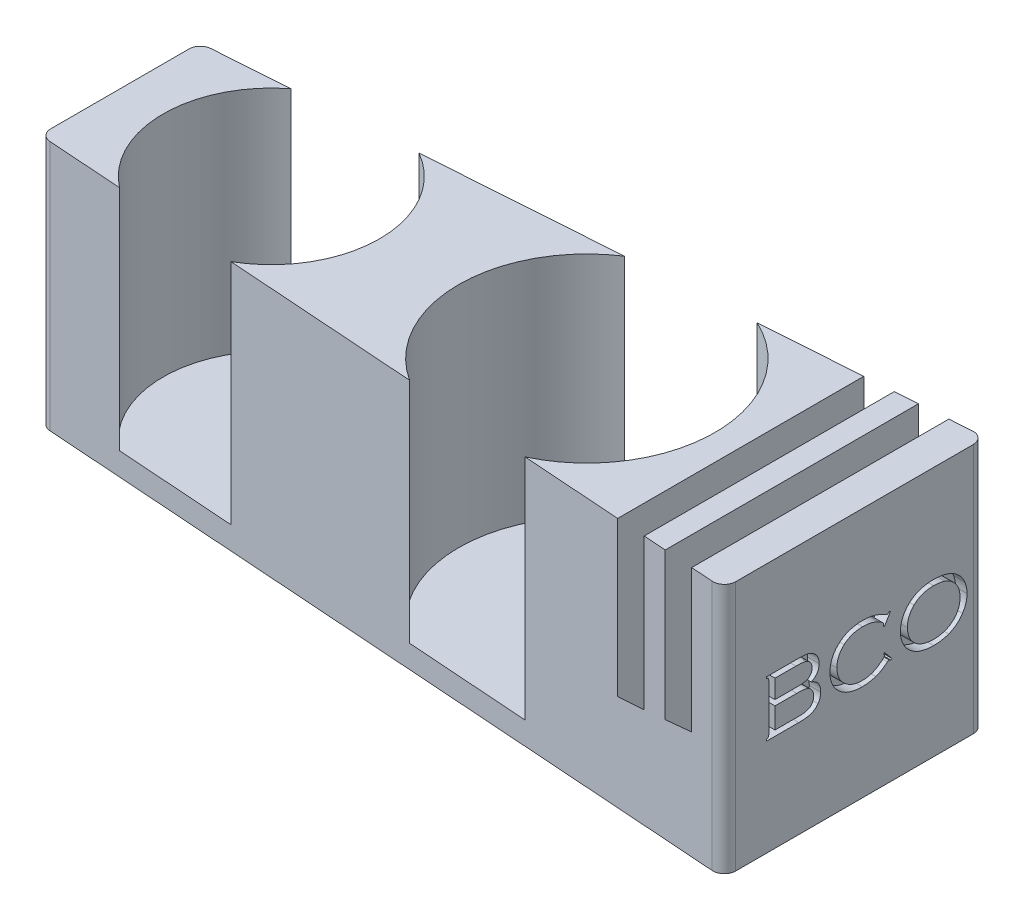
from build123d import *

# Parameters (mm, degrees)
BOSS_EXTRUDE1_DEPTH = 2
BOSS_EXTRUDE2_DEPTH = 20
BOSS_EXTRUDE3_DEPTH = 20
SKETCH5_R           = 12.25
CUT_EXTRUDE1_DEPTH  = 2.5
SKETCH6_W           = 22.580720552
SKETCH6_H           = 12.500036581
CUT_EXTRUDE3_DEPTH  = 2.5
BOSS_EXTRUDE4_DEPTH = 20
BOSS_EXTRUDE5_DEPTH = 20
SKETCH10_R          = 12.25
CUT_EXTRUDE4_DEPTH  = 2.5
CUT_EXTRUDE5_DEPTH  = 2.5
BOSS_EXTRUDE6_DEPTH = 20
SKETCH13_R          = 9.5
CUT_EXTRUDE6_DEPTH  = 20
SKETCH14_R          = 11.25
CUT_EXTRUDE7_DEPTH  = 20
CUT_EXTRUDE8_DEPTH  = 1
FILLET2_R           = 1


with BuildPart() as part:
    # Sketch1 → Boss-Extrude1 (new body)
    with BuildSketch(Plane(origin=(0, 0, 0), x_dir=(1, 0, 0), z_dir=(0, 1, 0))):
        Polygon((0, 7), (64.5, 11.5), (64.5, -11.5), (0, -7), align=None)
    extrude(amount=BOSS_EXTRUDE1_DEPTH)

    # Sketch2 → Boss-Extrude2 (add)
    with BuildSketch(Plane(origin=(0, 2, 0), x_dir=(1, 0, 0), z_dir=(0, 1, 0))):
        Polygon((61.502303199, 11.290858363), (61.497417875, -11.290517526), (64.5, -11.5), (64.5, 11.5), align=None)
    extrude(amount=BOSS_EXTRUDE2_DEPTH)

    # Sketch4 → Boss-Extrude3 (add)
    with BuildSketch(Plane(origin=(0, 2, 0), x_dir=(1, 0, 0), z_dir=(0, 1, 0))):
        Polygon((61.497417875, -11.290517526), (61.502303199, 11.290858363), (58.995164106, 11.115941682), (58.995163799, -11.11594166), align=None)
    extrude(amount=BOSS_EXTRUDE3_DEPTH)

    # Sketch5 → Cut-Extrude1 (cut)
    with BuildSketch(Plane(origin=(58.995163952, 0, 8.13e-07), x_dir=(-1.3778228676003005e-08, 0, 1.0), z_dir=(-1.0, 0, -1.3778228676003005e-08))):
        with Locations((0, 14.252883097)):
            Circle(SKETCH5_R)
    extrude(amount=-CUT_EXTRUDE1_DEPTH, mode=Mode.SUBTRACT)

    # Sketch6 → Cut-Extrude3 (cut)
    with BuildSketch(Plane(origin=(61.495163952, 0, 8.47e-07), x_dir=(-1.3778228676003005e-08, 0, 1.0), z_dir=(-1.0, 0, -1.3778228676003005e-08))):
        with Locations((-8.58e-07, 15.74998171)):
            Rectangle(SKETCH6_W, SKETCH6_H)
    extrude(amount=CUT_EXTRUDE3_DEPTH, mode=Mode.SUBTRACT)

    # Sketch8 → Boss-Extrude4 (add)
    with BuildSketch(Plane(origin=(0, 2, 0), x_dir=(1, 0, 0), z_dir=(0, 1, 0))):
        Polygon((58.995164106, 11.115941682), (57.006604835, 10.977204988), (57.006604835, -10.977204988), (58.995163799, -11.11594166), align=None)
    extrude(amount=BOSS_EXTRUDE4_DEPTH)

    # Sketch9 → Boss-Extrude5 (add)
    with BuildSketch(Plane(origin=(0, 2, 0), x_dir=(1, 0, 0), z_dir=(0, 1, 0))):
        Polygon((57.006604835, 10.977204988), (54.508882385, 10.802945283), (54.508862519, -10.802943897), (57.006604835, -10.977204988), align=None)
    extrude(amount=BOSS_EXTRUDE5_DEPTH)

    # Sketch10 → Cut-Extrude4 (cut)
    with BuildSketch(Plane(origin=(54.508872452, 0, 5.0119e-05), x_dir=(-9.194676961695594e-07, 0, 0.9999999999995773), z_dir=(-0.9999999999995773, 0, -9.194676961695594e-07))):
        with Locations((0, 14.224043544)):
            Circle(SKETCH10_R)
    extrude(amount=-CUT_EXTRUDE4_DEPTH, mode=Mode.SUBTRACT)

    # Sketch11 → Cut-Extrude5 (cut)
    with BuildSketch(Plane(origin=(57.008872452, 0, 5.2418e-05), x_dir=(-9.194676961695594e-07, 0, 0.9999999999995773), z_dir=(-0.9999999999995773, 0, -9.194676961695594e-07))):
        Polygon((-10.977416316, 8.787240161), (-10.977416316, 22), (11.07155829, 22), (10.977310072, 8.78702565), align=None)
    extrude(amount=CUT_EXTRUDE5_DEPTH, mode=Mode.SUBTRACT)

    # Sketch12 → Boss-Extrude6 (add)
    with BuildSketch(Plane(origin=(0, 2, 0), x_dir=(1, 0, 0), z_dir=(0, 1, 0))):
        Polygon((54.508903175, 10.802946733), (0, 7), (0, -7), (54.508862519, -10.802943897), align=None)
    extrude(amount=BOSS_EXTRUDE6_DEPTH)

    # Sketch13 → Cut-Extrude6 (cut)
    with BuildSketch(Plane(origin=(0, 22, 0), x_dir=(1, 0, 0), z_dir=(0, 1, 0))):
        with Locations((13.3, 0)):
            Circle(SKETCH13_R)
    extrude(amount=-CUT_EXTRUDE6_DEPTH, mode=Mode.SUBTRACT)

    # Sketch14 → Cut-Extrude7 (cut)
    with BuildSketch(Plane(origin=(0, 22, 0), x_dir=(1, 0, 0), z_dir=(0, 1, 0))):
        with Locations((41, 0)):
            Circle(SKETCH14_R)
    extrude(amount=-CUT_EXTRUDE7_DEPTH, mode=Mode.SUBTRACT)

    # Sketch15 → Cut-Extrude8 (cut)
    # profile 1 of 3: a face of its own
    with BuildSketch(Plane(origin=(64.5, 0, 0), x_dir=(0, 0, -1), z_dir=(1, 0, 0))):
        with BuildLine():
            add(Edge.make_bspline(
                [(-3.799670209, 11.061446796), (-3.766246688, 11.049058341), (-3.700423101, 11.024660775), (-3.605939555, 10.982613521), (-3.518268608, 10.934518215), (-3.437506514, 10.881280131), (-3.362893674, 10.823819199), (-3.294256211, 10.762065154), (-3.23275847, 10.694907748), (-3.177048912, 10.62335214), (-3.127721557, 10.546837437), (-3.087025629, 10.46430895), (-3.050082384, 10.378575784), (-3.022053711, 10.287168543), (-2.998078713, 10.191973061), (-2.982689472, 10.09131981), (-2.972854991, 9.986307199), (-2.971708357, 9.914607514), (-2.971124744, 9.878113915)],
                knots=[0, 0, 0, 0, 1.097804428, 2.161993195, 3.182125724, 4.174299236, 5.138504866, 6.080495971, 7.014434366, 7.939414527, 8.871249096, 9.812608627, 10.770688326, 11.743368762, 12.753836012, 13.791998788, 14.876174847, 16, 16, 16, 16], degree=3))
            add(Edge.make_bspline(
                [(-2.971124744, 9.878113915), (-2.971659429, 9.842680276), (-2.97272059, 9.772357053), (-2.983525185, 9.668651126), (-3.001656774, 9.567806476), (-3.027183848, 9.470607917), (-3.058952466, 9.376294698), (-3.098819728, 9.285567632), (-3.144919747, 9.197581596), (-3.18133952, 9.142059584), (-3.199505866, 9.114364955)],
                knots=[0, 0, 0, 0, 1.049969914, 2.083818419, 3.086349734, 4.0842008, 5.05995154, 6.032876141, 7.018789763, 8, 8, 8, 8], degree=3))
            add(Edge.make_bspline(
                [(-3.199505866, 9.114364955), (-3.238588889, 9.062637036), (-3.316145604, 8.959987672), (-3.461208841, 8.831917816), (-3.624787324, 8.72766453), (-3.77650202, 8.661327725), (-3.90908332, 8.619392641), (-4.020140456, 8.593782315), (-4.140377096, 8.569570898), (-4.271435878, 8.552633281), (-4.412693727, 8.537338989), (-4.564360275, 8.527140917), (-4.725883505, 8.520629481), (-4.836761468, 8.519891349), (-4.893775117, 8.519511801)],
                knots=[0, 0, 0, 0, 1.242460611, 2.46555039, 3.691603958, 4.955024015, 5.632425558, 6.359724433, 7.142501372, 7.986797785, 8.896135902, 9.870847805, 10.905186092, 12, 12, 12, 12], degree=3))
            Line((-4.893775117, 8.519511801), (-7.729949976, 8.519511801))
            Line((-7.729949976, 8.519511801), (-7.729949976, 8.655478236))
            add(Edge.make_bspline(
                [(-7.729949976, 8.655478236), (-7.711360728, 8.661386131), (-7.676605517, 8.672431772), (-7.630400033, 8.694802253), (-7.593338257, 8.719829311), (-7.565435121, 8.750561413), (-7.547028033, 8.789288679), (-7.535088965, 8.83723176), (-7.526318586, 8.895587306), (-7.526111812, 8.938347235), (-7.526000323, 8.961402715)],
                knots=[0, 0, 0, 0, 1.143860438, 2.138607913, 3.003713363, 3.754644928, 4.544830376, 5.492870617, 6.648195317, 8, 8, 8, 8], degree=3))
            Line((-7.526000323, 8.961402715), (-7.526000323, 12.972412553))
            add(Edge.make_bspline(
                [(-7.526000323, 12.972412553), (-7.526093765, 12.995474411), (-7.526267067, 13.038246169), (-7.535300143, 13.096865855), (-7.546748119, 13.145350982), (-7.565774472, 13.184383007), (-7.592933314, 13.216087063), (-7.630227262, 13.241216836), (-7.676717319, 13.262338831), (-7.711381598, 13.272756611), (-7.729949976, 13.278337032)],
                knots=[0, 0, 0, 0, 1.348407392, 2.500828586, 3.466505965, 4.254705557, 5.01937148, 5.882302788, 6.865627628, 8, 8, 8, 8], degree=3))
            Line((-7.729949976, 13.278337032), (-7.729949976, 13.414303468))
            Line((-7.729949976, 13.414303468), (-4.81092057, 13.414303468))
            add(Edge.make_bspline(
                [(-4.81092057, 13.414303468), (-4.742206694, 13.413574999), (-4.611023002, 13.412184257), (-4.423443008, 13.39941716), (-4.254468675, 13.378916272), (-4.102059215, 13.349067375), (-3.96276978, 13.30975869), (-3.833623918, 13.258481729), (-3.712701029, 13.196093696), (-3.638784558, 13.14528431), (-3.602093983, 13.120063604)],
                knots=[0, 0, 0, 0, 1.302346774, 2.486348698, 3.561918447, 4.52674738, 5.427466683, 6.301148707, 7.156726092, 8, 8, 8, 8], degree=3))
            add(Edge.make_bspline(
                [(-3.602093983, 13.120063604), (-3.562717484, 13.089818921), (-3.485178025, 13.030261662), (-3.383784719, 12.926277128), (-3.297800455, 12.812431323), (-3.227214203, 12.689111187), (-3.174138822, 12.555027863), (-3.13475544, 12.412697506), (-3.110790431, 12.260103174), (-3.108347567, 12.155286019), (-3.10709118, 12.101377578)],
                knots=[0, 0, 0, 0, 1.00902135, 1.986945823, 2.943469155, 3.904753493, 4.867763269, 5.869042653, 6.904028757, 8, 8, 8, 8], degree=3))
            add(Edge.make_bspline(
                [(-3.10709118, 12.101377578), (-3.108921067, 12.044200882), (-3.112488497, 11.932732876), (-3.146359039, 11.771961167), (-3.201088254, 11.62306239), (-3.277100616, 11.485325696), (-3.376370131, 11.360076254), (-3.496924957, 11.246935384), (-3.638460471, 11.144606813), (-3.744682849, 11.089812017), (-3.799670209, 11.061446796)],
                knots=[0, 0, 0, 0, 1.033878134, 2.015582265, 2.958526813, 3.896667073, 4.850612724, 5.838968453, 6.881314652, 8, 8, 8, 8], degree=3))
        make_face()
        with BuildLine():
            Line((-6.982134582, 11.306823722), (-5.112596098, 11.306823722))
            add(Edge.make_bspline(
                [(-5.112596098, 11.306823722), (-5.050270599, 11.306759789), (-4.934090287, 11.306640611), (-4.772624798, 11.312535052), (-4.636524502, 11.319153478), (-4.490233077, 11.332583782), (-4.329291461, 11.361818585), (-4.210326806, 11.403399665), (-4.15233315, 11.423669877)],
                knots=[0, 0, 0, 0, 1.152530373, 2.148419817, 2.987862657, 3.672033346, 4.865147838, 6, 6, 6, 6], degree=3))
            add(Edge.make_bspline(
                [(-4.15233315, 11.423669877), (-4.119140466, 11.438866452), (-4.054249138, 11.468575586), (-3.968579229, 11.531138755), (-3.892846924, 11.602484237), (-3.830283945, 11.686081171), (-3.779842727, 11.77857086), (-3.745195263, 11.879562484), (-3.723095896, 11.987118116), (-3.720348366, 12.061254829), (-3.718940138, 12.099253102)],
                knots=[0, 0, 0, 0, 1.024106575, 2.002116977, 2.966860763, 3.940604793, 4.925131127, 5.917030414, 6.932387936, 8, 8, 8, 8], degree=3))
            add(Edge.make_bspline(
                [(-3.718940138, 12.099253102), (-3.721189597, 12.149825617), (-3.725583552, 12.24861084), (-3.765970267, 12.389881124), (-3.82816684, 12.521328121), (-3.890310192, 12.595087687), (-3.921827553, 12.632496465)],
                knots=[0, 0, 0, 0, 1.036984646, 2.025581684, 2.998630549, 4, 4, 4, 4], degree=3))
            add(Edge.make_bspline(
                [(-3.921827553, 12.632496465), (-3.950399876, 12.660380144), (-4.007702008, 12.716301192), (-4.109723634, 12.783411927), (-4.223171613, 12.836803091), (-4.327593595, 12.868755901), (-4.418841297, 12.889834345), (-4.497417639, 12.901920457), (-4.584119402, 12.913772706), (-4.680102114, 12.923556505), (-4.784695177, 12.929001588), (-4.897971357, 12.934811964), (-5.019811254, 12.937822567), (-5.104096979, 12.938217085), (-5.147649945, 12.938420944)],
                knots=[0, 0, 0, 0, 1.103503862, 2.213090076, 3.362305382, 4.565552712, 5.22922152, 5.954632266, 6.765888387, 7.652787982, 8.625317062, 9.665859362, 10.793879429, 12, 12, 12, 12], degree=3))
            Line((-5.147649945, 12.938420944), (-6.982134582, 12.938420944))
            Line((-6.982134582, 12.938420944), (-6.982134582, 11.306823722))
        make_face(mode=Mode.SUBTRACT)
        with BuildLine():
            Line((-6.982134582, 8.995394324), (-5.033990503, 8.995394324))
            add(Edge.make_bspline(
                [(-5.033990503, 8.995394324), (-4.968484982, 8.995973158), (-4.8466656, 8.997049603), (-4.677329648, 9.00041132), (-4.535225199, 9.008742771), (-4.383556546, 9.023412757), (-4.216121656, 9.054537268), (-4.094354451, 9.103174305), (-4.034424757, 9.127111808)],
                knots=[0, 0, 0, 0, 1.160628187, 2.158398363, 3.000517238, 3.681538704, 4.858931865, 6, 6, 6, 6], degree=3))
            add(Edge.make_bspline(
                [(-4.034424757, 9.127111808), (-4.000212177, 9.144916315), (-3.93278749, 9.180004673), (-3.842410028, 9.248904587), (-3.765141347, 9.331299862), (-3.699026571, 9.424640447), (-3.647191666, 9.529040785), (-3.60974517, 9.641992581), (-3.587006492, 9.762835612), (-3.584337899, 9.84614709), (-3.582973703, 9.888736293)],
                knots=[0, 0, 0, 0, 0.986580937, 1.944311435, 2.893761687, 3.870034466, 4.863717831, 5.86748961, 6.909851071, 8, 8, 8, 8], degree=3))
            add(Edge.make_bspline(
                [(-3.582973703, 9.888736293), (-3.585183045, 9.944938352), (-3.589492421, 10.054561847), (-3.630179806, 10.211897657), (-3.696378113, 10.356821054), (-3.76010131, 10.440387675), (-3.792234544, 10.482527209)],
                knots=[0, 0, 0, 0, 1.047504044, 2.043182339, 3.013249758, 4, 4, 4, 4], degree=3))
            add(Edge.make_bspline(
                [(-3.792234544, 10.482527209), (-3.822401109, 10.514769561), (-3.882240338, 10.578726381), (-3.989961961, 10.655758141), (-4.108622419, 10.716318206), (-4.216970449, 10.753970953), (-4.312005831, 10.775729324), (-4.393167227, 10.790636258), (-4.483561794, 10.803079768), (-4.583064894, 10.813965787), (-4.691919476, 10.82049974), (-4.809422101, 10.827610709), (-4.936253023, 10.83026804), (-5.023722374, 10.830711448), (-5.06904435, 10.830941199)],
                knots=[0, 0, 0, 0, 1.159768913, 2.300549619, 3.463384632, 4.656993155, 5.307997226, 6.028165016, 6.828143068, 7.709081128, 8.661864719, 9.697794496, 10.807119288, 12, 12, 12, 12], degree=3))
            Line((-5.06904435, 10.830941199), (-6.982134582, 10.830941199))
            Line((-6.982134582, 10.830941199), (-6.982134582, 8.995394324))
        make_face(mode=Mode.SUBTRACT)
    # profile 2 of 3: a face of its own
    with BuildSketch(Plane(origin=(64.5, 0, 0), x_dir=(0, 0, -1), z_dir=(1, 0, 0))):
        with BuildLine():
            Line((3.147364839, 12.938420944), (2.617308189, 12.05251464))
            Line((2.617308189, 12.05251464), (2.520644552, 12.113062193))
            add(Edge.make_bspline(
                [(2.520644552, 12.113062193), (2.530162311, 12.146823562), (2.546654667, 12.205325204), (2.550770925, 12.265900796), (2.552511685, 12.29151814)],
                knots=[0, 0, 0, 0, 1.154202433, 2, 2, 2, 2], degree=3))
            add(Edge.make_bspline(
                [(2.552511685, 12.29151814), (2.550801365, 12.305192437), (2.547111512, 12.334693427), (2.523349214, 12.378271109), (2.485882356, 12.422596157), (2.43551082, 12.470659576), (2.370127506, 12.519899021), (2.290768299, 12.571962308), (2.197575843, 12.626987002), (2.129563267, 12.662561565), (2.093624966, 12.681359403)],
                knots=[0, 0, 0, 0, 0.528427833, 1.140032483, 1.879037193, 2.768916703, 3.822049475, 5.035818927, 6.433706882, 8, 8, 8, 8], degree=3))
            add(Edge.make_bspline(
                [(2.093624966, 12.681359403), (2.040846842, 12.707578409), (1.935408925, 12.759957637), (1.771524809, 12.825393708), (1.6041125, 12.880146858), (1.434400343, 12.927997904), (1.260227006, 12.96233598), (1.08300921, 12.988154802), (0.901697631, 13.003122129), (0.779663241, 13.005302777), (0.718027048, 13.006404162)],
                knots=[0, 0, 0, 0, 0.990833998, 1.979446473, 2.964339273, 3.952521199, 4.942889807, 5.947602928, 6.963391035, 8, 8, 8, 8], degree=3))
            add(Edge.make_bspline(
                [(0.718027048, 13.006404162), (0.636148881, 13.004993454), (0.476188626, 13.002237441), (0.242640878, 12.974270561), (0.020596284, 12.932903594), (-0.189674579, 12.872174104), (-0.388106688, 12.793323635), (-0.574725663, 12.697150136), (-0.750482316, 12.58520431), (-0.856408318, 12.49631744), (-0.909321223, 12.451916044)],
                knots=[0, 0, 0, 0, 1.116881908, 2.181982346, 3.205473248, 4.196440491, 5.163727822, 6.11461875, 7.058201043, 8, 8, 8, 8], degree=3))
            add(Edge.make_bspline(
                [(-0.909321223, 12.451916044), (-0.96006352, 12.404165549), (-1.060150808, 12.30997948), (-1.18841649, 12.150910825), (-1.299229038, 11.983617274), (-1.389226632, 11.804671851), (-1.457865392, 11.614725546), (-1.507967825, 11.415156822), (-1.538560606, 11.20508892), (-1.541813682, 11.061551604), (-1.543477175, 10.98815239)],
                knots=[0, 0, 0, 0, 1.014640989, 2.001341491, 2.970512027, 3.935371108, 4.913448052, 5.908657242, 6.930571361, 8, 8, 8, 8], degree=3))
            add(Edge.make_bspline(
                [(-1.543477175, 10.98815239), (-1.541445398, 10.915097287), (-1.537451981, 10.771508945), (-1.505687622, 10.561157973), (-1.455181958, 10.360043096), (-1.382193347, 10.168393728), (-1.288432939, 9.986574464), (-1.174436167, 9.81399939), (-1.040897315, 9.650115199), (-0.93671554, 9.552631643), (-0.883827517, 9.50314398)],
                knots=[0, 0, 0, 0, 1.045243101, 2.054404389, 3.037758508, 4.008189886, 4.982846867, 5.959767557, 6.964273164, 8, 8, 8, 8], degree=3))
            add(Edge.make_bspline(
                [(-0.883827517, 9.50314398), (-0.82979522, 9.457082592), (-0.722739167, 9.365819573), (-0.548018769, 9.248827964), (-0.364622269, 9.149263959), (-0.17112711, 9.06870713), (0.030900531, 9.004200384), (0.242802956, 8.960593878), (0.463337982, 8.931440664), (0.613830297, 8.928770056), (0.690408866, 8.927411106)],
                knots=[0, 0, 0, 0, 0.992433811, 1.966343341, 2.934746802, 3.906992647, 4.893800048, 5.896242675, 6.929495341, 8, 8, 8, 8], degree=3))
            add(Edge.make_bspline(
                [(0.690408866, 8.927411106), (0.765568046, 8.928810155), (0.914286302, 8.931578468), (1.133412191, 8.960685023), (1.346085111, 9.004754649), (1.551879575, 9.067876611), (1.751127954, 9.148586089), (1.943094276, 9.248354906), (2.129128396, 9.365000317), (2.245233666, 9.456042004), (2.303948046, 9.502081743)],
                knots=[0, 0, 0, 0, 1.031172007, 2.040390831, 3.028950235, 4.009892534, 4.991015447, 5.975791656, 6.976358799, 8, 8, 8, 8], degree=3))
            add(Edge.make_bspline(
                [(2.303948046, 9.502081743), (2.32896568, 9.520913292), (2.376266886, 9.556518377), (2.439491544, 9.611121613), (2.494195312, 9.659816709), (2.539098577, 9.703971392), (2.573650303, 9.74454985), (2.598427699, 9.780644398), (2.615166664, 9.812700453), (2.618120208, 9.833719776), (2.619432665, 9.843060068)],
                knots=[0, 0, 0, 0, 1.587426528, 3.001370576, 4.234572792, 5.301084547, 6.1931032, 6.9301606, 7.524598697, 8, 8, 8, 8], degree=3))
            add(Edge.make_bspline(
                [(2.619432665, 9.843060068), (2.618250102, 9.852664633), (2.615490458, 9.875077971), (2.604097397, 9.912637592), (2.584605252, 9.957842473), (2.567961049, 9.990111116), (2.558885112, 10.007706924)],
                knots=[0, 0, 0, 0, 0.656862919, 1.532863812, 2.654692323, 4, 4, 4, 4], degree=3))
            Line((2.558885112, 10.007706924), (2.644926371, 10.075690141))
            Line((2.644926371, 10.075690141), (3.283331274, 9.301318803))
            Line((3.283331274, 9.301318803), (3.194103301, 9.226962159))
            add(Edge.make_bspline(
                [(3.194103301, 9.226962159), (3.17851158, 9.240892316), (3.149924135, 9.266433278), (3.105810043, 9.295005923), (3.0666259, 9.315887794), (3.04026751, 9.318293279), (3.028394208, 9.319376845)],
                knots=[0, 0, 0, 0, 1.293860952, 2.372295961, 3.266790553, 4, 4, 4, 4], degree=3))
            add(Edge.make_bspline(
                [(3.028394208, 9.319376845), (3.02052154, 9.317886663), (3.00155907, 9.314297341), (2.970537924, 9.299305983), (2.933463168, 9.273696064), (2.906501205, 9.253289273), (2.891365535, 9.241833488)],
                knots=[0, 0, 0, 0, 0.602339461, 1.450822395, 2.56896506, 4, 4, 4, 4], degree=3))
            add(Edge.make_bspline(
                [(2.891365535, 9.241833488), (2.83880657, 9.201557917), (2.73913337, 9.125179033), (2.594712189, 9.020891424), (2.4643028, 8.932737807), (2.308901382, 8.834715467), (2.112654652, 8.733153815), (1.948802629, 8.671863048), (1.865243845, 8.640606907)],
                knots=[0, 0, 0, 0, 0.997120743, 1.890946972, 2.68215169, 3.367178705, 4.657353487, 6, 6, 6, 6], degree=3))
            add(Edge.make_bspline(
                [(1.865243845, 8.640606907), (1.774035997, 8.611102243), (1.589254998, 8.551327766), (1.29833565, 8.495640518), (0.995232495, 8.457464905), (0.788262095, 8.453530217), (0.682973201, 8.451528583)],
                knots=[0, 0, 0, 0, 0.955610556, 1.936003082, 2.950014347, 4, 4, 4, 4], degree=3))
            add(Edge.make_bspline(
                [(0.682973201, 8.451528583), (0.581626652, 8.453507712), (0.383369311, 8.457379346), (0.093323186, 8.489421013), (-0.181485031, 8.543894493), (-0.442595379, 8.617586033), (-0.688588476, 8.715210694), (-0.921377398, 8.831558359), (-1.139027332, 8.971302732), (-1.271178079, 9.080758115), (-1.337403047, 9.13560971)],
                knots=[0, 0, 0, 0, 1.114924198, 2.181050147, 3.205656836, 4.194615827, 5.161896158, 6.113211609, 7.054469962, 8, 8, 8, 8], degree=3))
            add(Edge.make_bspline(
                [(-1.337403047, 9.13560971), (-1.402476706, 9.195905408), (-1.530817831, 9.314823227), (-1.697661052, 9.513552706), (-1.839491284, 9.724191814), (-1.954564238, 9.947962028), (-2.045750105, 10.183469108), (-2.109023421, 10.432037488), (-2.148401717, 10.692649856), (-2.152988688, 10.870809305), (-2.155326133, 10.961596445)],
                knots=[0, 0, 0, 0, 1.029468752, 2.03036344, 3.005483654, 3.972873955, 4.946545143, 5.931937644, 6.94614926, 8, 8, 8, 8], degree=3))
            add(Edge.make_bspline(
                [(-2.155326133, 10.961596445), (-2.153552831, 11.033530972), (-2.150066634, 11.174949608), (-2.126686393, 11.383658823), (-2.085796297, 11.584502156), (-2.031126172, 11.778955644), (-1.958435286, 11.965494476), (-1.86922015, 12.144285764), (-1.767410159, 12.31787734), (-1.685553915, 12.424735026), (-1.644389764, 12.478471988)],
                knots=[0, 0, 0, 0, 1.057821681, 2.079609136, 3.08340757, 4.068984952, 5.046566163, 6.022259667, 7.005427102, 8, 8, 8, 8], degree=3))
            add(Edge.make_bspline(
                [(-1.644389764, 12.478471988), (-1.610559709, 12.519291284), (-1.543162596, 12.600612545), (-1.433148252, 12.714181085), (-1.317618021, 12.820350477), (-1.195789391, 12.918967898), (-1.067172627, 13.008635207), (-0.933289212, 13.092232357), (-0.792371024, 13.166307169), (-0.64581649, 13.23367393), (-0.492557786, 13.291565971), (-0.333479728, 13.342979287), (-0.16825863, 13.386422634), (0.003476937, 13.421163227), (0.18098523, 13.449146762), (0.365052906, 13.467658591), (0.555343611, 13.479736372), (0.684370546, 13.481427753), (0.749894181, 13.482286685)],
                knots=[0, 0, 0, 0, 0.945323297, 1.883297627, 2.817501084, 3.742673649, 4.67655684, 5.612445219, 6.556058172, 7.514122137, 8.487631749, 9.476265062, 10.49494205, 11.532877102, 12.600271702, 13.698751591, 14.831359033, 16, 16, 16, 16], degree=3))
            add(Edge.make_bspline(
                [(0.749894181, 13.482286685), (0.837424093, 13.480372077), (1.01255696, 13.476541262), (1.273779822, 13.447897048), (1.533037188, 13.402608945), (1.789456918, 13.337100685), (2.044407038, 13.254131093), (2.296836147, 13.151765323), (2.547584439, 13.03189583), (2.709585056, 12.938776576), (2.791515184, 12.891682482)],
                knots=[0, 0, 0, 0, 0.976200939, 1.953216504, 2.927882183, 3.909755422, 4.902711129, 5.916307441, 6.946194151, 8, 8, 8, 8], degree=3))
            add(Edge.make_bspline(
                [(2.791515184, 12.891682482), (2.809520012, 12.881739169), (2.838198787, 12.865901082), (2.869977634, 12.858369555), (2.881805395, 12.855566398)],
                knots=[0, 0, 0, 0, 1.255620471, 2, 2, 2, 2], degree=3))
            add(Edge.make_bspline(
                [(2.881805395, 12.855566398), (2.891243343, 12.857895583), (2.915887654, 12.863977536), (2.95263856, 12.894226173), (2.999787079, 12.937857783), (3.032290519, 12.974836311), (3.050701201, 12.995781784)],
                knots=[0, 0, 0, 0, 0.518788388, 1.354657101, 2.501618075, 4, 4, 4, 4], degree=3))
            Line((3.050701201, 12.995781784), (3.147364839, 12.938420944))
        make_face()
    # profile 3 of 3: a face of its own
    with BuildSketch(Plane(origin=(64.5, 0, 0), x_dir=(0, 0, -1), z_dir=(1, 0, 0))):
        with BuildLine():
            add(Edge.make_bspline(
                [(6.945927122, 13.482286685), (7.051178182, 13.480377729), (7.256871585, 13.476647034), (7.557205161, 13.443735301), (7.841971701, 13.392662306), (8.111080897, 13.319101884), (8.364906272, 13.224784894), (8.602865319, 13.108421421), (8.825751394, 12.971500319), (8.9613031, 12.863705322), (9.028975399, 12.809890174)],
                knots=[0, 0, 0, 0, 1.129612801, 2.20761577, 3.239501009, 4.232676901, 5.19856252, 6.14208603, 7.072462372, 8, 8, 8, 8], degree=3))
            add(Edge.make_bspline(
                [(9.028975399, 12.809890174), (9.065175131, 12.778496122), (9.137515208, 12.715759523), (9.237671793, 12.613649977), (9.331663878, 12.506939788), (9.419335741, 12.395383109), (9.498527193, 12.277482335), (9.571020266, 12.154663375), (9.637331551, 12.027126656), (9.675686857, 11.938742174), (9.694998483, 11.894241212)],
                knots=[0, 0, 0, 0, 1.005456374, 2.009263195, 2.99930056, 3.989477404, 4.985134177, 5.978096491, 6.981985854, 8, 8, 8, 8], degree=3))
            add(Edge.make_bspline(
                [(9.694998483, 11.894241212), (9.723169082, 11.819334041), (9.779841448, 11.668639103), (9.835776385, 11.431868406), (9.871010964, 11.187151519), (9.875453514, 11.021205825), (9.877703381, 10.937164977)],
                knots=[0, 0, 0, 0, 0.978870405, 1.969248235, 2.971554498, 4, 4, 4, 4], degree=3))
            add(Edge.make_bspline(
                [(9.877703381, 10.937164977), (9.876350125, 10.879768342), (9.873653717, 10.765403652), (9.855891875, 10.595083536), (9.822896773, 10.428287922), (9.781258462, 10.263378156), (9.724144659, 10.102239686), (9.656231649, 9.943352511), (9.575308289, 9.787407953), (9.512315995, 9.687542393), (9.480426453, 9.63698594)],
                knots=[0, 0, 0, 0, 0.998791673, 1.990125373, 2.97492797, 3.955229716, 4.947022809, 5.946137479, 6.960242109, 8, 8, 8, 8], degree=3))
            add(Edge.make_bspline(
                [(9.480426453, 9.63698594), (9.443088177, 9.582490062), (9.368932353, 9.474258317), (9.242467285, 9.324833012), (9.107373342, 9.185393399), (8.960161944, 9.059038789), (8.802499571, 8.943871781), (8.633988433, 8.840826801), (8.455227921, 8.748610106), (8.329752813, 8.698047921), (8.266288676, 8.67247404)],
                knots=[0, 0, 0, 0, 1.004651634, 1.995292206, 2.974496599, 3.956306444, 4.943468318, 5.942396716, 6.959283489, 8, 8, 8, 8], degree=3))
            add(Edge.make_bspline(
                [(8.266288676, 8.67247404), (8.217262963, 8.654547815), (8.118660548, 8.618493897), (7.965877563, 8.574501809), (7.809011255, 8.535898823), (7.646862869, 8.505514801), (7.480032089, 8.480640068), (7.308044133, 8.464369663), (7.131618173, 8.452994329), (7.012512871, 8.45202076), (6.952300549, 8.451528583)],
                knots=[0, 0, 0, 0, 0.934826263, 1.880158805, 2.84626528, 3.827761024, 4.834209658, 5.866742649, 6.921556159, 8, 8, 8, 8], degree=3))
            add(Edge.make_bspline(
                [(6.952300549, 8.451528583), (6.847758262, 8.453449484), (6.643126601, 8.457209465), (6.34419899, 8.490065741), (6.060508939, 8.541190759), (5.792709476, 8.614483876), (5.540481396, 8.70929546), (5.303824679, 8.825372417), (5.082012797, 8.96234066), (4.947190206, 9.070114638), (4.87987465, 9.123925095)],
                knots=[0, 0, 0, 0, 1.127024368, 2.206043841, 3.238781121, 4.232709334, 5.195758597, 6.140066014, 7.071353774, 8, 8, 8, 8], degree=3))
            add(Edge.make_bspline(
                [(4.87987465, 9.123925095), (4.843661795, 9.155666604), (4.771659825, 9.218778203), (4.671971964, 9.321675563), (4.578074083, 9.428621791), (4.492318576, 9.541689513), (4.412458036, 9.658636209), (4.338637441, 9.780384276), (4.271647318, 9.907267592), (4.233141699, 9.995414939), (4.213851565, 10.039574057)],
                knots=[0, 0, 0, 0, 1.011096338, 2.010361431, 3.006660641, 3.998842894, 4.989016114, 5.98008274, 6.988083389, 8, 8, 8, 8], degree=3))
            add(Edge.make_bspline(
                [(4.213851565, 10.039574057), (4.18574065, 10.113427464), (4.129562102, 10.261020571), (4.073116383, 10.491963049), (4.037997712, 10.728585623), (4.033440347, 10.888532388), (4.031146668, 10.96903211)],
                knots=[0, 0, 0, 0, 0.994164706, 1.98679875, 2.986774507, 4, 4, 4, 4], degree=3))
            add(Edge.make_bspline(
                [(4.031146668, 10.96903211), (4.032446233, 11.028561504), (4.035028096, 11.146829318), (4.053463335, 11.322596683), (4.083972821, 11.494884137), (4.128173261, 11.663290917), (4.183164071, 11.828625711), (4.2516201, 11.989863813), (4.331019848, 12.148315003), (4.393633159, 12.249130152), (4.425236882, 12.300016042)],
                knots=[0, 0, 0, 0, 1.014818375, 2.016152715, 3.009649952, 3.995044388, 4.981990861, 5.977595005, 6.97920226, 8, 8, 8, 8], degree=3))
            add(Edge.make_bspline(
                [(4.425236882, 12.300016042), (4.461824584, 12.35383251), (4.534604163, 12.46088323), (4.660375733, 12.608656505), (4.79616164, 12.746006464), (4.943640887, 12.871630091), (5.101478723, 12.986961591), (5.270799513, 13.091149488), (5.451516512, 13.184104923), (5.578396103, 13.235400262), (5.642561372, 13.261341228)],
                knots=[0, 0, 0, 0, 0.989484021, 1.968263269, 2.947264875, 3.925421255, 4.912438463, 5.918631609, 6.947414939, 8, 8, 8, 8], degree=3))
            add(Edge.make_bspline(
                [(5.642561372, 13.261341228), (5.68945367, 13.278589212), (5.784109202, 13.313405528), (5.932081092, 13.355167637), (6.085420227, 13.392470126), (6.245640777, 13.423318001), (6.41189365, 13.447591841), (6.58452374, 13.465121836), (6.763015593, 13.478816333), (6.88429048, 13.481117263), (6.945927122, 13.482286685)],
                knots=[0, 0, 0, 0, 0.902246132, 1.821249792, 2.77533096, 3.75252328, 4.767441222, 5.809311129, 6.886606205, 8, 8, 8, 8], degree=3))
        make_face()
        with BuildLine():
            add(Edge.make_bspline(
                [(6.945927122, 13.006404162), (6.85768724, 13.004627052), (6.685323756, 13.001155731), (6.43356887, 12.972376406), (6.196312988, 12.923333468), (5.97237654, 12.857070283), (5.76355007, 12.769081967), (5.567718523, 12.664089868), (5.386418389, 12.53833096), (5.278239253, 12.43971467), (5.224039689, 12.390306253)],
                knots=[0, 0, 0, 0, 1.128525398, 2.204406482, 3.235699143, 4.224388685, 5.186685981, 6.129057779, 7.062626515, 8, 8, 8, 8], degree=3))
            add(Edge.make_bspline(
                [(5.224039689, 12.390306253), (5.177651868, 12.342739073), (5.085887503, 12.248641703), (4.967898622, 12.092095626), (4.867528092, 11.926965227), (4.785303686, 11.75285268), (4.721198887, 11.569890474), (4.675370611, 11.3777496), (4.648852891, 11.176201878), (4.644969937, 11.038862908), (4.642995626, 10.96903211)],
                knots=[0, 0, 0, 0, 1.008980271, 1.995964253, 2.971497028, 3.941626714, 4.916862578, 5.912784804, 6.938743291, 8, 8, 8, 8], degree=3))
            add(Edge.make_bspline(
                [(4.642995626, 10.96903211), (4.644950909, 10.898845512), (4.648786914, 10.761148758), (4.675480015, 10.5589208), (4.721223096, 10.366079325), (4.78506816, 10.18229172), (4.867562215, 10.007930549), (4.967854231, 9.842744282), (5.086190352, 9.686163369), (5.177694362, 9.591469803), (5.224039689, 9.543509016)],
                knots=[0, 0, 0, 0, 1.064021848, 2.087469132, 3.086175838, 4.064091798, 5.031846932, 6.004991929, 6.989560106, 8, 8, 8, 8], degree=3))
            add(Edge.make_bspline(
                [(5.224039689, 9.543509016), (5.277848664, 9.494058083), (5.385443831, 9.395177154), (5.566703086, 9.269792669), (5.762721032, 9.16446324), (5.972417265, 9.076781667), (6.19738224, 9.010480998), (6.436044801, 8.961343059), (6.689581295, 8.932678893), (6.863354024, 8.929194574), (6.952300549, 8.927411106)],
                knots=[0, 0, 0, 0, 0.930753399, 1.861112707, 2.800244815, 3.763399471, 4.75301258, 5.785180892, 6.866332692, 8, 8, 8, 8], degree=3))
            add(Edge.make_bspline(
                [(6.952300549, 8.927411106), (7.041600386, 8.929196055), (7.216077746, 8.932683554), (7.470677845, 8.961333417), (7.71037546, 9.01052739), (7.936162383, 9.076534924), (8.146343152, 9.164737926), (8.343194159, 9.269746692), (8.525496974, 9.395159709), (8.633828687, 9.494057708), (8.687997073, 9.543509016)],
                knots=[0, 0, 0, 0, 1.134093072, 2.21583345, 3.248703155, 4.239073098, 5.198770883, 6.138490523, 7.069201797, 8, 8, 8, 8], degree=3))
            add(Edge.make_bspline(
                [(8.687997073, 9.543509016), (8.734437079, 9.591040639), (8.825957616, 9.684712453), (8.94260159, 9.840826961), (9.043467839, 10.003058141), (9.124479959, 10.175103963), (9.18886612, 10.354571207), (9.232501952, 10.54286559), (9.261881846, 10.738663104), (9.26451318, 10.872256492), (9.265854422, 10.94035169)],
                knots=[0, 0, 0, 0, 1.024908978, 2.019814964, 3.001416639, 3.969700935, 4.950023213, 5.939130583, 6.949534016, 8, 8, 8, 8], degree=3))
            add(Edge.make_bspline(
                [(9.265854422, 10.94035169), (9.264494831, 11.013395013), (9.261824762, 11.156843112), (9.232826105, 11.366099539), (9.189580421, 11.565170385), (9.124314881, 11.752128977), (9.044583067, 11.929799509), (8.943032051, 12.094667948), (8.826519659, 12.25105612), (8.734507295, 12.34355175), (8.687997073, 12.390306253)],
                knots=[0, 0, 0, 0, 1.090457954, 2.141525268, 3.15014253, 4.128699665, 5.094406147, 6.053265364, 7.015968536, 8, 8, 8, 8], degree=3))
            add(Edge.make_bspline(
                [(8.687997073, 12.390306253), (8.630223099, 12.442174133), (8.516996396, 12.543825945), (8.333300147, 12.672525539), (8.143449046, 12.777968981), (8.010284077, 12.827757836), (7.94443063, 12.852379685)],
                knots=[0, 0, 0, 0, 1.055352731, 2.068303461, 3.04472719, 4, 4, 4, 4], degree=3))
            add(Edge.make_bspline(
                [(7.94443063, 12.852379685), (7.869020893, 12.875738362), (7.715284875, 12.923359137), (7.471790273, 12.969657786), (7.214040013, 13.000304666), (7.036666089, 13.004339875), (6.945927122, 13.006404162)],
                knots=[0, 0, 0, 0, 0.933174879, 1.902441171, 2.926954332, 4, 4, 4, 4], degree=3))
        make_face(mode=Mode.SUBTRACT)
    extrude(amount=-CUT_EXTRUDE8_DEPTH, mode=Mode.SUBTRACT)

    # Fillet2
    fillet2_edges = [part.edges().sort_by_distance(p)[0] for p in [
        (0, 11, -7),
        (64.5, 11, -11.5),
        (64.5, 11, 11.5),
        (0, 11, 7),
    ]]
    fillet(fillet2_edges, radius=FILLET2_R)


solid = part.part
